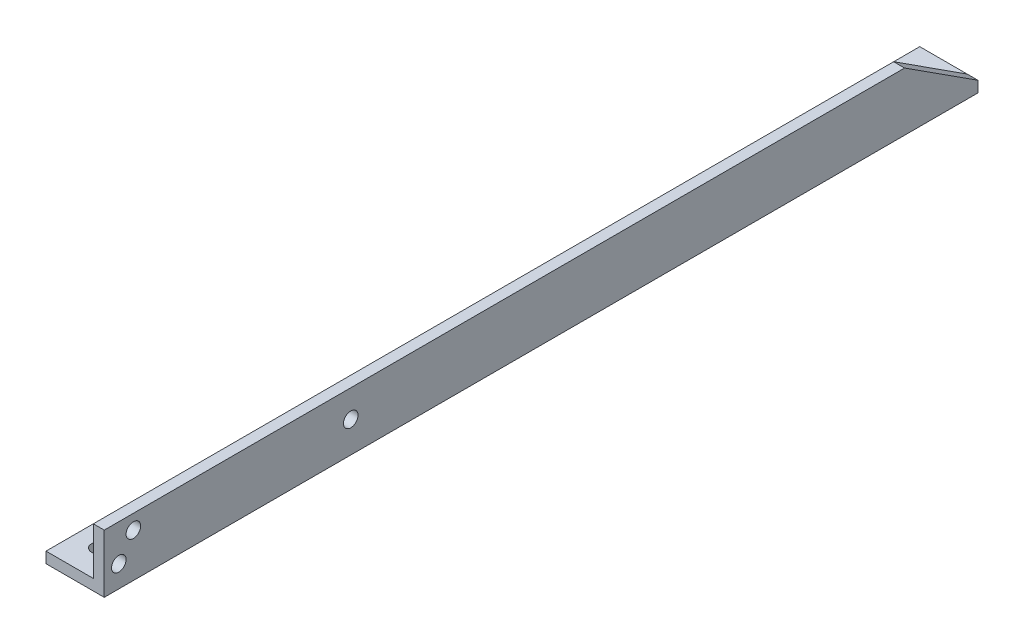
from build123d import *

# Parameters (mm, degrees)
BOSS_EXTRUDE1_DEPTH     = 381
CUT_EXTRUDE2_DEPTH      = 383.403015687
CUT_EXTRUDE2_DEPTH_BACK = 383.403015687
CUT_EXTRUDE3_REACH      = 384.403
SKETCH10_R              = 3.175
CUT_EXTRUDE4_REACH      = 384.69
SKETCH11_R              = 3.175
CUT_EXTRUDE5_REACH      = 384.403
SKETCH12_R              = 3.175


with BuildPart() as part:
    # Sketch1 → Boss-Extrude1 (new body)
    with BuildSketch(Plane.XY):
        Polygon((0, 0), (0, -25.4), (-25.4, -25.4), (-25.4, -20.6375), (-4.7625, -20.6375), (-4.7625, 0), align=None)
    extrude(amount=BOSS_EXTRUDE1_DEPTH)

    # Sketch9 → Cut-Extrude2 (cut, two sides: drawn at the far end of the back side and taken through both)
    with BuildSketch(Plane.ZY.offset(4.7625).offset(-CUT_EXTRUDE2_DEPTH_BACK)):
        Polygon((-649.877066877, -439.409233154), (0, -20.6375), (32.02660759, 0), (681.903674467, 418.771733154), (-155.63979184, 1718.525866908), (-1487.420533185, 860.3449006), align=None)
    extrude(amount=CUT_EXTRUDE2_DEPTH + CUT_EXTRUDE2_DEPTH_BACK, mode=Mode.SUBTRACT)

    # Sketch10 → Cut-Extrude3 (cut, up to next)
    with BuildSketch(Plane.ZY.offset(4.7625), mode=Mode.PRIVATE) as cut_extrude3_sk1:
        with Locations(Location((374.65, -15.875, 0), (0, 0, 270))):
            Circle(SKETCH10_R)
    cut_extrude3_tool1 = extrude(cut_extrude3_sk1.sketch, amount=-CUT_EXTRUDE3_REACH, mode=Mode.PRIVATE) & part.part
    # Sketch10 → Cut-Extrude3 (cut, up to next)
    with BuildSketch(Plane.ZY.offset(4.7625), mode=Mode.PRIVATE) as cut_extrude3_sk2:
        with Locations(Location((368.3, -6.35, 0), (0, 0, 270))):
            Circle(SKETCH10_R)
    cut_extrude3_tool2 = extrude(cut_extrude3_sk2.sketch, amount=-CUT_EXTRUDE3_REACH, mode=Mode.PRIVATE) & part.part
    add(cut_extrude3_tool1.solids().sort_by_distance((-4.7625, -15.875, 374.65))[0], mode=Mode.SUBTRACT)
    add(cut_extrude3_tool2.solids().sort_by_distance((-4.7625, -6.35, 368.3))[0], mode=Mode.SUBTRACT)

    # Sketch11 → Cut-Extrude4 (cut, up to next)
    with BuildSketch(Plane(origin=(0, 0, 0), x_dir=(0, 0, -1), z_dir=(1, 0, 0)), mode=Mode.PRIVATE) as cut_extrude4_sk1:
        with Locations(Location((-273.509298487, -11.929615818, 0), (0, 0, 90))):
            Circle(SKETCH11_R)
    cut_extrude4_tool1 = extrude(cut_extrude4_sk1.sketch, amount=-CUT_EXTRUDE4_REACH, mode=Mode.PRIVATE) & part.part
    add(cut_extrude4_tool1.solids().sort_by_distance((0, -11.929616, 273.509298))[0], mode=Mode.SUBTRACT)

    # Sketch12 → Cut-Extrude5 (cut, up to next)
    with BuildSketch(Plane(origin=(0, -20.6375, 0), x_dir=(1, 0, 0), z_dir=(0, 1, 0)), mode=Mode.PRIVATE) as cut_extrude5_sk1:
        with Locations(Location((-15.08125, -368.3, 0), (0, 0, 270))):
            Circle(SKETCH12_R)
    cut_extrude5_tool1 = extrude(cut_extrude5_sk1.sketch, amount=-CUT_EXTRUDE5_REACH, mode=Mode.PRIVATE) & part.part
    add(cut_extrude5_tool1.solids().sort_by_distance((-15.08125, -20.6375, 368.3))[0], mode=Mode.SUBTRACT)


solid = part.part
